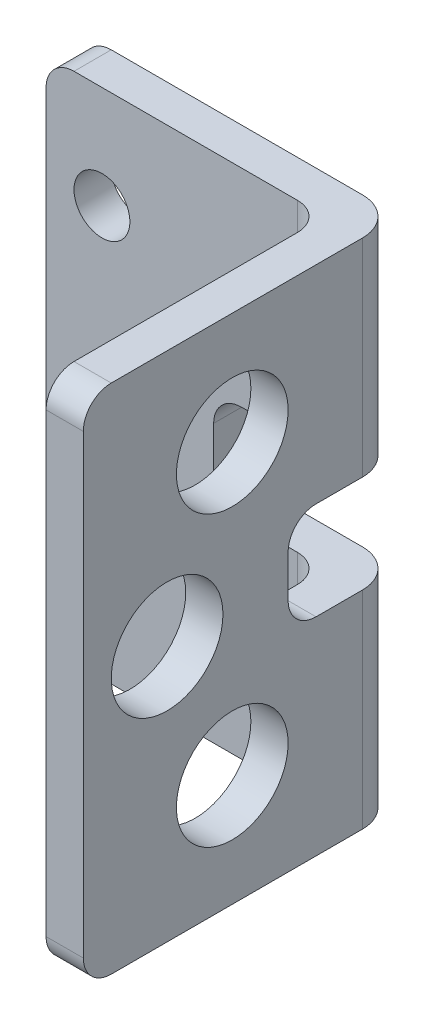
from build123d import *

# Parameters (mm, degrees)
BOSS_EXTRUDE1_DEPTH = 27.5
SKETCH2_R           = 3
CUT_EXTRUDE1_DEPTH  = 27.5
SKETCH3_W           = 6
SKETCH3_H           = 5.25
CUT_EXTRUDE2_DEPTH  = 8
SKETCH4_R           = 1.5
CUT_EXTRUDE3_DEPTH  = 9
FILLET1_R           = 1.5


with BuildPart() as part:
    # Sketch1 → Boss-Extrude1 (new body)
    with BuildSketch(Plane(origin=(0, 0, 0), x_dir=(1, 0, 0), z_dir=(0, 1, 0))):
        with BuildLine():
            Line((0, 0), (15, 0))
            Line((15, 0), (15, -15))
            Line((15, -15), (17, -15))
            Line((17, -15), (17, 0))
            ThreePointArc((17, 0), (16.414213562, 1.414213562), (15, 2))
            Line((15, 2), (0, 2))
            Line((0, 2), (0, 0))
        make_face()
    extrude(amount=BOSS_EXTRUDE1_DEPTH)

    # Sketch2 → Cut-Extrude1 (cut)
    with BuildSketch(Plane(origin=(17, 0, 0), x_dir=(0, 0, -1), z_dir=(1, 0, 0))):
        with Locations((-7, 6)):
            Circle(SKETCH2_R)
        with Locations((-10.5, 13.75)):
            Circle(SKETCH2_R)
        with Locations((-7, 21.5)):
            Circle(SKETCH2_R)
    extrude(amount=-CUT_EXTRUDE1_DEPTH, mode=Mode.SUBTRACT)

    # Sketch3 → Cut-Extrude2 (cut)
    with BuildSketch(Plane(origin=(17, 0, 0), x_dir=(0, 0, -1), z_dir=(1, 0, 0))):
        with Locations((-1, 13.75)):
            Rectangle(SKETCH3_W, SKETCH3_H)
    extrude(amount=-CUT_EXTRUDE2_DEPTH, mode=Mode.SUBTRACT)

    # Sketch4 → Cut-Extrude3 (cut)
    with BuildSketch(Plane(origin=(0, 0, -2), x_dir=(-1, 0, 0), z_dir=(0, 0, -1))):
        with Locations((-3, 5.5)):
            Circle(SKETCH4_R)
        with Locations((-3, 22)):
            Circle(SKETCH4_R)
    extrude(amount=-CUT_EXTRUDE3_DEPTH, mode=Mode.SUBTRACT)

    # Fillet1
    fillet1_edges = [part.edges().sort_by_distance(p)[0] for p in [
        (0, 0, -1),
        (15, 21.9375, 0),
        (16, 27.5, 15),
        (15, 5.5625, 0),
        (16, 11.125, 4),
        (16, 16.375, 4),
        (9, 16.375, -1),
        (9, 11.125, -1),
        (0, 27.5, -1),
        (16, 0, 15),
    ]]
    fillet(fillet1_edges, radius=FILLET1_R)


solid = part.part
